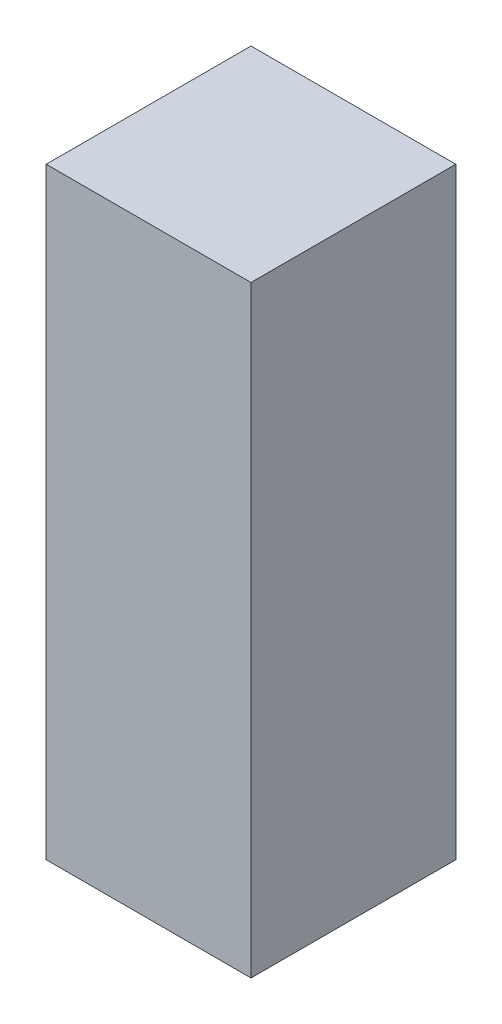
from build123d import *

# Parameters (mm, degrees)
SKETCH_1_W      = 1.7
SKETCH_1_H      = 1.7
SKETCH_1_W_2    = 1.2
SKETCH_1_H_2    = 1.2
EXTRUDE_1_DEPTH = 3
SKETCH_2_W      = 1.7
SKETCH_2_H      = 1.7
EXTRUDE_2_DEPTH = 2


with BuildPart() as part:
    # 草图1 → 凸台-拉伸1 (new body)
    with BuildSketch(Plane(origin=(0, 0, 0), x_dir=(1, 0, 0), z_dir=(0, 1, 0))):
        Rectangle(SKETCH_1_W, SKETCH_1_H)
        Rectangle(SKETCH_1_W_2, SKETCH_1_H_2, mode=Mode.SUBTRACT)
    extrude(amount=EXTRUDE_1_DEPTH)

    # 草图2 → 凸台-拉伸2 (add)
    with BuildSketch(Plane(origin=(0, 3, 0), x_dir=(1, 0, 0), z_dir=(0, 1, 0))):
        Rectangle(SKETCH_2_W, SKETCH_2_H)
    extrude(amount=EXTRUDE_2_DEPTH)


solid = part.part
